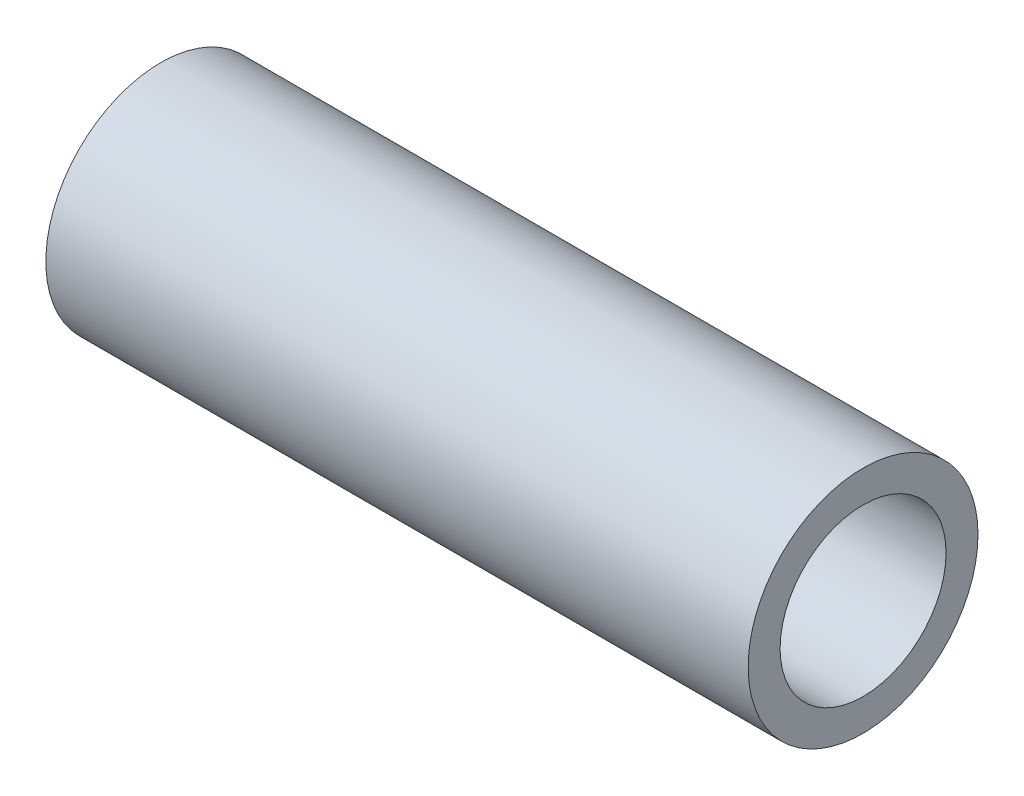
from build123d import *

# Parameters (mm, degrees)
SKETCH1_R           = 9
SKETCH1_R_2         = 6.5
BOSS_EXTRUDE1_DEPTH = 27.5


with BuildPart() as part:
    # Sketch1 → Boss-Extrude1 (new, symmetric)
    with BuildSketch(Plane(origin=(0, 0, 0), x_dir=(0, 0, -1), z_dir=(1, 0, 0))):
        Circle(SKETCH1_R)
        Circle(SKETCH1_R_2, mode=Mode.SUBTRACT)
    extrude(amount=BOSS_EXTRUDE1_DEPTH, both=True)


solid = part.part
